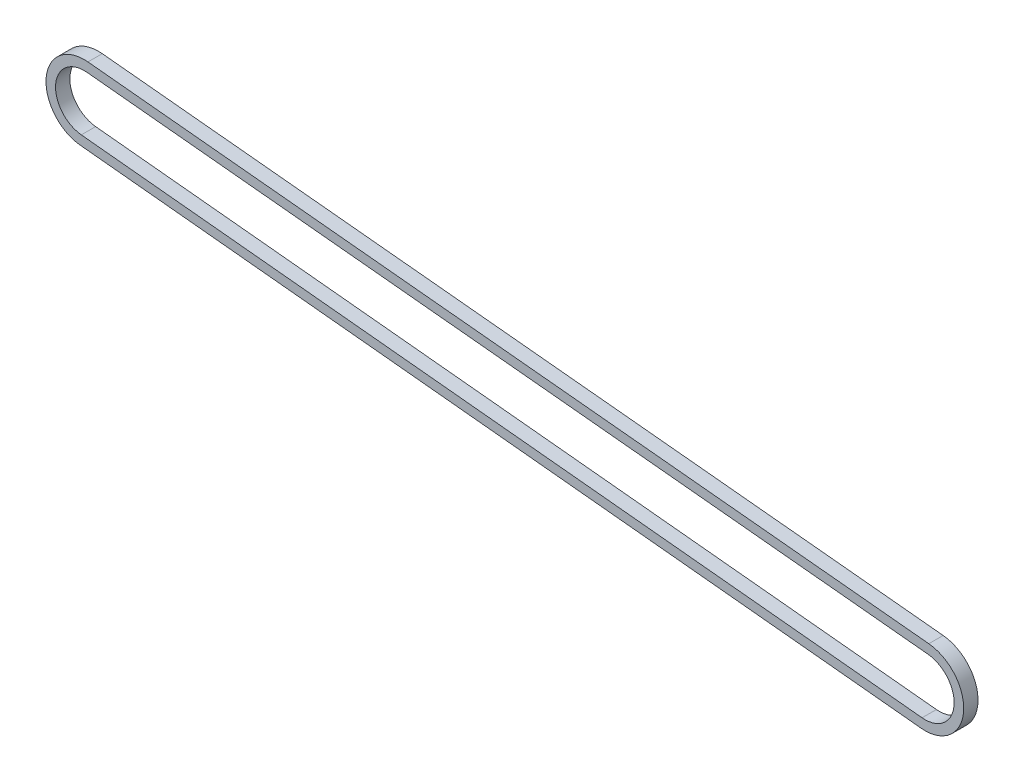
from build123d import *

# Parameters (mm, degrees)
EXTRUDE_THIN1_DEPTH = 3


with BuildPart() as part:
    # Sketch2 → Extrude-Thin1 (new body)
    with BuildSketch(Plane(origin=(-30.526995128, 76.330399028, 0), x_dir=(1, 0, 0), z_dir=(0, 0, 1))):
        with BuildLine():
            Line((-175.393121968, 25.54841324), (0.800564806, 8.070390077))
            ThreePointArc((0.800564806, 8.070390077), (8.069891158, -0.805578491), (-0.810591866, -8.069389124))
            Line((-0.810591866, -8.069389124), (-176.982425714, 9.627545964))
            ThreePointArc((-176.982425714, 9.627545964), (-184.143263486, 18.38213794), (-175.393121968, 25.54841324))
        make_face()
        with BuildLine():
            Line((-175.590548554, 23.558181408), (0.60313822, 6.080158245))
            ThreePointArc((0.60313822, 6.080158245), (6.079782364, -0.606915485), (-0.610692515, -6.079404136))
            Line((-0.610692515, -6.079404136), (-176.782526363, 11.617530952))
            ThreePointArc((-176.782526363, 11.617530952), (-182.153154693, 18.183474933), (-175.590548554, 23.558181408))
        make_face(mode=Mode.SUBTRACT)
    extrude(amount=EXTRUDE_THIN1_DEPTH)


solid = part.part
